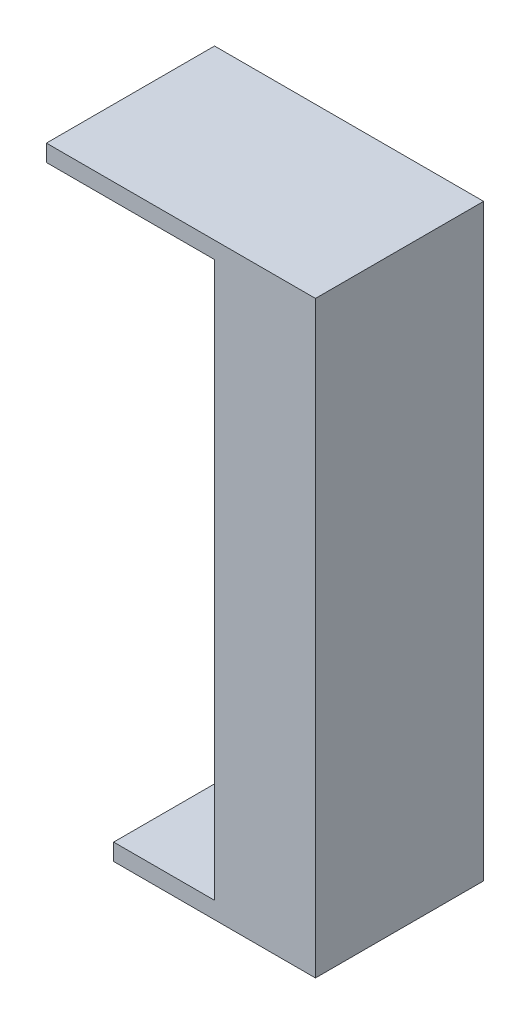
from build123d import *

# Parameters (mm, degrees)
SALIENTE_EXTRUIR1_DEPTH = 25


with BuildPart() as part:
    # Croquis1 → Saliente-Extruir1 (new, symmetric)
    with BuildSketch(Plane.XY):
        Polygon((-25, 87.5), (-25, 82.5), (25, 82.5), (25, -82.5), (-5, -82.5), (-5, -87.5), (55, -87.5), (55, 87.5), align=None)
    extrude(amount=SALIENTE_EXTRUIR1_DEPTH, both=True)


solid = part.part
